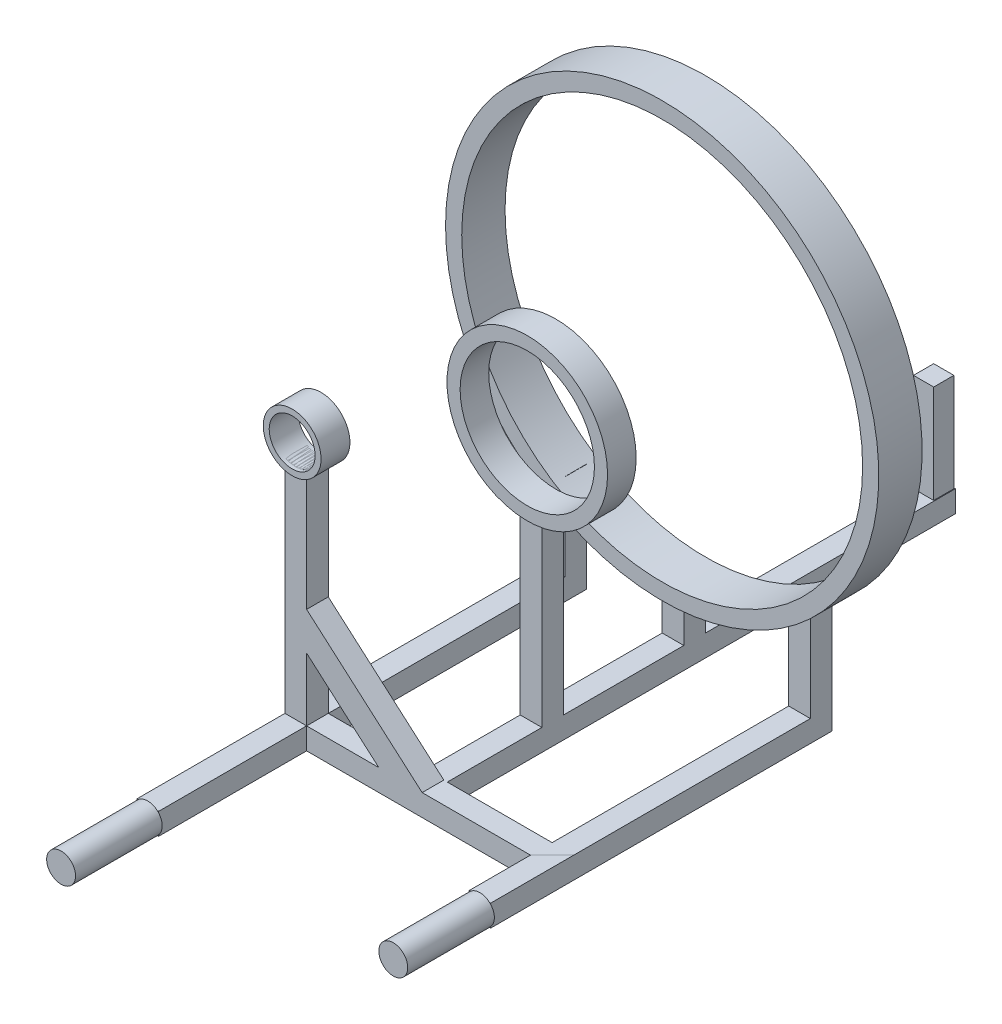
from build123d import *

# Parameters (mm, degrees)
SKETCH3_W            = 1.5
SKETCH3_H            = 1.5
SKETCH7_W            = 1.479410264
SKETCH7_H            = 1.499410264
BOSS_EXTRUDE1_DEPTH  = 19
SKETCH12_R           = 2
BOSS_EXTRUDE4_DEPTH  = 1
SKETCH16_R           = 1.59
CUT_EXTRUDE1_DEPTH   = 10
SKETCH17_R           = 1
BOSS_EXTRUDE5_DEPTH  = 6
SKETCH18_R           = 1
BOSS_EXTRUDE6_DEPTH  = 6
SKETCH19_W           = 1.5
SKETCH19_H           = 1.5
BOSS_EXTRUDE7_DEPTH  = 8.05
SKETCH21_W           = 1.5
SKETCH21_H           = 1.5
BOSS_EXTRUDE8_DEPTH  = 17.68
SKETCH22_R           = 5.56
BOSS_EXTRUDE9_DEPTH  = 0.99
SKETCH23_R           = 4.65
CUT_EXTRUDE2_DEPTH   = 5
SKETCH24_W           = 1.5
SKETCH24_H           = 1.5
BOSS_EXTRUDE10_DEPTH = 9.83
SKETCH25_W           = 1.5
SKETCH25_H           = 1.5
BOSS_EXTRUDE11_DEPTH = 3
SKETCH27_R           = 15
BOSS_EXTRUDE12_DEPTH = 1.5
SKETCH28_R           = 13.88
CUT_EXTRUDE3_DEPTH   = 3
SKETCH30_R           = 1.59
CUT_EXTRUDE5_DEPTH   = 3
SKETCH31_W           = 1.5
SKETCH31_H           = 1.5
BOSS_EXTRUDE13_DEPTH = 17.3
SKETCH32_W           = 1.4
SKETCH32_H           = 1.4
BOSS_EXTRUDE14_DEPTH = 6.8
SKETCH33_W           = 1.5
SKETCH33_H           = 1.5
BOSS_EXTRUDE15_DEPTH = 17.88
SKETCH34_W           = 1.5
SKETCH34_H           = 1.5
BOSS_EXTRUDE16_DEPTH = 6
SKETCH36_W           = 3
SKETCH36_H           = 1.5
SKETCH40_W           = 2.072351247
SKETCH40_H           = 1.5
CUT_EXTRUDE6_DEPTH   = 17.13


with BuildPart() as part:
    # Sweep3: sweep along a path in Sketch4
    with BuildLine(Plane(origin=(0, 0, 0), x_dir=(1, 0, 0), z_dir=(0, 1, 0))) as sweep3_path:
        Line((0, 0), (0, 11))
        Line((0, 11), (17, 11))
        Line((17, 11), (17, 6))
    # Sketch3 → Sweep3 (sweep)
    with BuildSketch(Plane.XY):
        with Locations((-0.000294868, 0)):
            Rectangle(SKETCH3_W, SKETCH3_H)
    sweep(path=sweep3_path.line, transition=Transition.RIGHT)

    # Sketch7 → Boss-Extrude1 (add)
    with BuildSketch(Plane(origin=(0, 0, 0), x_dir=(1, 0, 0), z_dir=(0, 1, 0))):
        with Locations((0.01, 11)):
            Rectangle(SKETCH7_W, SKETCH7_H)
    extrude(amount=BOSS_EXTRUDE1_DEPTH)

    # Sketch17 → Boss-Extrude5 (add)
    with BuildSketch(Plane.XY):
        with Locations(Location((0, 0, 0), (0, 0, 138.615926737))):
            Circle(SKETCH17_R)
    extrude(amount=BOSS_EXTRUDE5_DEPTH)

    # Sketch18 → Boss-Extrude6 (add)
    with BuildSketch(Plane.XY.offset(-6)):
        with Locations(Location((17.000589736, 0, 0), (0, 0, 138.615926737))):
            Circle(SKETCH18_R)
    extrude(amount=BOSS_EXTRUDE6_DEPTH)

    # Sketch30 → Cut-Extrude5 (cut)
    with BuildSketch(Plane.XY.offset(-10)):
        with Locations(Location((0, 17.5, 0), (0, 0, 180))):
            Circle(SKETCH30_R)
    extrude(amount=-CUT_EXTRUDE5_DEPTH, mode=Mode.SUBTRACT)


with BuildPart() as body_2:
    # Sketch12 → Boss-Extrude4 (new, symmetric)
    with BuildSketch(Plane.XY.offset(-11)):
        with Locations((0, 17.5)):
            Circle(SKETCH12_R)
    extrude(amount=BOSS_EXTRUDE4_DEPTH, both=True)

    # Sketch16 → Cut-Extrude1 (cut)
    with BuildSketch(Plane(origin=(0, 0, -12), x_dir=(-1, 0, 0), z_dir=(0, 0, -1))):
        with Locations((0, 17.5)):
            Circle(SKETCH16_R)
    extrude(amount=-CUT_EXTRUDE1_DEPTH, mode=Mode.SUBTRACT)


with BuildPart() as body_3:
    # Sketch19 → Boss-Extrude7 (new body)
    with BuildSketch(Plane.XY.offset(-11.75)):
        with Locations((8.24, 0)):
            Rectangle(SKETCH19_W, SKETCH19_H)
    extrude(amount=-BOSS_EXTRUDE7_DEPTH)

    # Sketch21 → Boss-Extrude8 (add)
    with BuildSketch(Plane(origin=(0, 0.75, 0), x_dir=(1, 0, 0), z_dir=(0, 1, 0))):
        with Locations((8.24, 19.05)):
            Rectangle(SKETCH21_W, SKETCH21_H)
    extrude(amount=BOSS_EXTRUDE8_DEPTH)

    # Sketch22 → Boss-Extrude9 (add, symmetric)
    with BuildSketch(Plane.XY.offset(-19.05)):
        with Locations((8.219571099, 18.429988197)):
            Circle(SKETCH22_R)
    extrude(amount=BOSS_EXTRUDE9_DEPTH, both=True)

    # Sketch23 → Cut-Extrude2 (cut)
    with BuildSketch(Plane(origin=(0, 0, -20.04), x_dir=(-1, 0, 0), z_dir=(0, 0, -1))):
        with Locations((-8.219571099, 18.429988197)):
            Circle(SKETCH23_R)
    extrude(amount=-CUT_EXTRUDE2_DEPTH, mode=Mode.SUBTRACT)

    # Sketch24 → Boss-Extrude10 (add)
    with BuildSketch(Plane(origin=(0, 0, -19.8), x_dir=(-1, 0, 0), z_dir=(0, 0, -1))):
        with Locations((-8.24, 0)):
            Rectangle(SKETCH24_W, SKETCH24_H)
    extrude(amount=BOSS_EXTRUDE10_DEPTH)

    # Sketch25 → Boss-Extrude11 (add)
    with BuildSketch(Plane(origin=(0, 0.75, 0), x_dir=(1, 0, 0), z_dir=(0, 1, 0))):
        with Locations((8.24, 28.88)):
            Rectangle(SKETCH25_W, SKETCH25_H)
    extrude(amount=BOSS_EXTRUDE11_DEPTH)

    # Sketch27 → Boss-Extrude12 (add, symmetric)
    with BuildSketch(Plane(origin=(0, 0, -28.88), x_dir=(-1, 0, 0), z_dir=(0, 0, -1))):
        with Locations((-8.24, 18.43)):
            Circle(SKETCH27_R)
    extrude(amount=BOSS_EXTRUDE12_DEPTH, both=True)

    # Sketch28 → Cut-Extrude3 (cut)
    with BuildSketch(Plane(origin=(0, 0, -30.38), x_dir=(-1, 0, 0), z_dir=(0, 0, -1))):
        with Locations((-8.24, 18.43)):
            Circle(SKETCH28_R)
    extrude(amount=-CUT_EXTRUDE3_DEPTH, mode=Mode.SUBTRACT)

    # Sketch31 → Boss-Extrude13 (add)
    with BuildSketch(Plane(origin=(0, 0, -29.63), x_dir=(-1, 0, 0), z_dir=(0, 0, -1))):
        with Locations((-8.24, 0)):
            Rectangle(SKETCH31_W, SKETCH31_H)
    extrude(amount=BOSS_EXTRUDE13_DEPTH)

    # Sketch32 → Boss-Extrude14 (add)
    with BuildSketch(Plane(origin=(0, 0.75, 0), x_dir=(1, 0, 0), z_dir=(0, 1, 0))):
        with Locations((8.24, 46.18)):
            Rectangle(SKETCH32_W, SKETCH32_H)
    extrude(amount=BOSS_EXTRUDE14_DEPTH)


with BuildPart() as cut_extrude5_piece_1:
    # of the separate pieces the step leaves, piece 1, a body of its own (cut_extrude5_pieces)
    add(part.part.solids().sort_by_distance((0.749705132, 0.75, 0))[0])


    add(body_3.part)  # Boss-Extrude15 merges body 3
    # Sketch33 → Boss-Extrude15 (add)
    with BuildSketch(Plane(origin=(0, 0, -11.750294868), x_dir=(-1, 0, 0), z_dir=(0, 0, -1))):
        with Locations((-17.000294868, 0)):
            Rectangle(SKETCH33_W, SKETCH33_H)
    boss_extrude15 = extrude(amount=BOSS_EXTRUDE15_DEPTH)

    # Sketch34 → Boss-Extrude16 (add)
    with BuildSketch(Plane(origin=(0, 0.75, 0), x_dir=(1, 0, 0), z_dir=(0, 1, 0))):
        with Locations((17.000294868, 28.880294868)):
            Rectangle(SKETCH34_W, SKETCH34_H)
    boss_extrude16 = extrude(amount=BOSS_EXTRUDE16_DEPTH)

    # Mirror1: Boss-Extrude15, Boss-Extrude16 across plane
    add(boss_extrude15.mirror(Plane.ZY.offset(-8.500294868)))
    add(boss_extrude16.mirror(Plane.ZY.offset(-8.500294868)))

    # Sweep4: sweep along a path in Sketch39
    with BuildLine(Plane.XY.offset(-11.000294868)) as sweep4_path:
        Line((8.24, 0.75), (-0.31176151, 8.217084581))
    # Sketch36 → Sweep4 (sweep)
    with BuildSketch(Plane(origin=(0, 0.75, 0), x_dir=(1, 0, 0), z_dir=(0, 1, 0))):
        with Locations((7.249705132, 11.000294868)):
            Rectangle(SKETCH36_W, SKETCH36_H)
    sweep(path=sweep4_path.line)

    # Sketch40 → Cut-Extrude6 (cut)
    with BuildSketch(Plane(origin=(0, 8.217084581, 0), x_dir=(1, 0, 0), z_dir=(0, 1, 0))):
        with Locations((-1.765880756, 11.000294868)):
            Rectangle(SKETCH40_W, SKETCH40_H)
    extrude(amount=-CUT_EXTRUDE6_DEPTH, mode=Mode.SUBTRACT)


with BuildPart() as cut_extrude5_piece_2:
    # of the separate pieces the step leaves, piece 2, a body of its own (cut_extrude5_pieces)
    add(part.part.solids().sort_by_distance((0.749705132, 18.902156273, -10.250294868))[0])


with BuildPart() as cut_extrude5_piece_3:
    # of the separate pieces the step leaves, piece 3, a body of its own (cut_extrude5_pieces)
    add(part.part.solids().sort_by_distance((-0.729705132, 18.912667838, -10.250294868))[0])


solid = Compound([body_2.part, cut_extrude5_piece_1.part, cut_extrude5_piece_2.part, cut_extrude5_piece_3.part])
